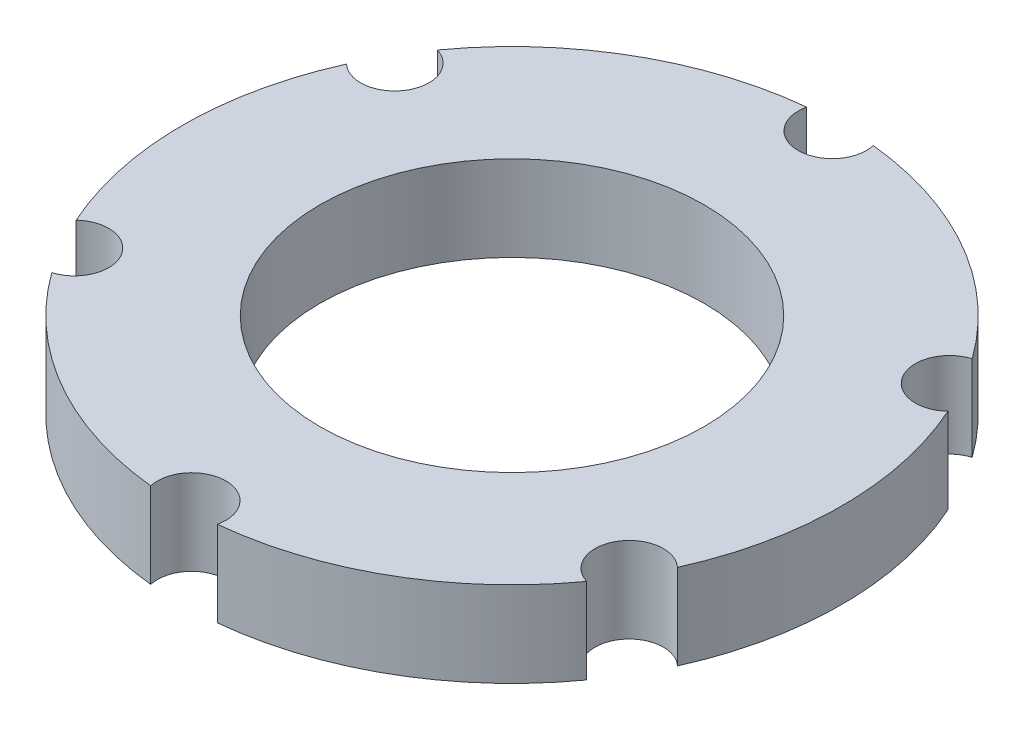
from build123d import *

# Parameters (mm, degrees)
SKETCH1_R           = 30.861
SKETCH1_R_2         = 14.2875
BOSS_EXTRUDE1_DEPTH = 6.35
SKETCH2_R           = 2.54
CUT_EXTRUDE1_DEPTH  = 6.35
SKETCH3_R           = 30.861
SKETCH3_R_2         = 24.511
CUT_EXTRUDE2_DEPTH  = 45.103572894


with BuildPart() as part:
    # Sketch1 → Boss-Extrude1 (new body)
    with BuildSketch(Plane(origin=(0, 0, 0), x_dir=(1, 0, 0), z_dir=(0, 1, 0))):
        with Locations(Location((0, 0, 0), (0, 0, 270))):
            Circle(SKETCH1_R)
        with Locations(Location((0, 0, 0), (0, 0, 270))):
            Circle(SKETCH1_R_2, mode=Mode.SUBTRACT)
    extrude(amount=BOSS_EXTRUDE1_DEPTH)

    # Sketch2 → Cut-Extrude1 (cut)
    with BuildSketch(Plane(origin=(0, 6.35, 0), x_dir=(1, 0, 0), z_dir=(0, 1, 0))):
        with Locations(Location((0, 23.8125, 0), (0, 0, 270))):
            Circle(SKETCH2_R)
        with Locations(Location((0, -23.8125, 0), (0, 0, 270))):
            Circle(SKETCH2_R)
        with Locations(Location((20.622229928, 11.90625, 0), (0, 0, 270))):
            Circle(SKETCH2_R)
        with Locations(Location((20.622229928, -11.90625, 0), (0, 0, 270))):
            Circle(SKETCH2_R)
        with Locations(Location((-20.622229928, 11.90625, 0), (0, 0, 270))):
            Circle(SKETCH2_R)
        with Locations(Location((-20.622229928, -11.90625, 0), (0, 0, 270))):
            Circle(SKETCH2_R)
    extrude(amount=-CUT_EXTRUDE1_DEPTH, mode=Mode.SUBTRACT)

    # Sketch3 → Cut-Extrude2 (cut, through all)
    with BuildSketch(Plane(origin=(0, 6.35, 0), x_dir=(1, 0, 0), z_dir=(0, 1, 0))):
        Circle(SKETCH3_R)
        Circle(SKETCH3_R_2, mode=Mode.SUBTRACT)
    extrude(amount=-CUT_EXTRUDE2_DEPTH, mode=Mode.SUBTRACT)


solid = part.part
